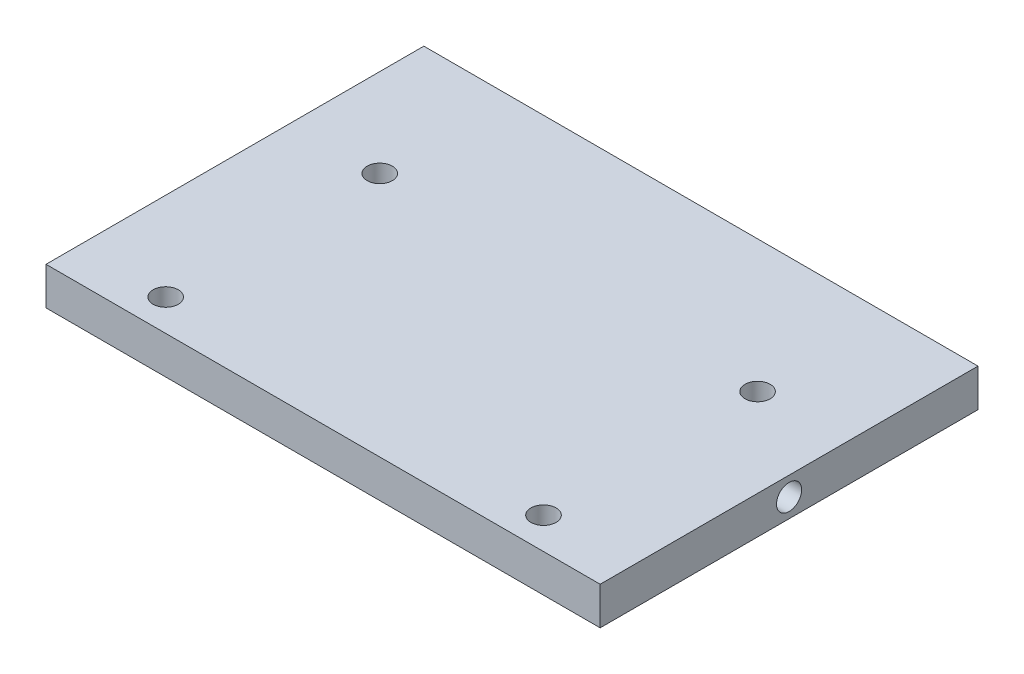
from build123d import *

# Parameters (mm, degrees)
SKETCH1_W           = 44
SKETCH1_H           = 30
BOSS_EXTRUDE1_DEPTH = 3
SKETCH2_R           = 1
CUT_EXTRUDE1_DEPTH  = 5
SKETCH3_R           = 1
CUT_EXTRUDE2_DEPTH  = 5


with BuildPart() as part:
    # Sketch1 → Boss-Extrude1 (new body)
    with BuildSketch(Plane(origin=(0, 0, 0), x_dir=(1, 0, 0), z_dir=(0, 1, 0))):
        Rectangle(SKETCH1_W, SKETCH1_H)
    extrude(amount=BOSS_EXTRUDE1_DEPTH)

    # Sketch2 → Cut-Extrude1 (cut)
    with BuildSketch(Plane.ZY.offset(22)):
        with Locations((0, 1.5)):
            Circle(SKETCH2_R)
    cut_extrude1 = extrude(amount=-CUT_EXTRUDE1_DEPTH, mode=Mode.SUBTRACT)

    # Mirror1: Cut-Extrude1 across plane
    add(cut_extrude1.mirror(Plane(origin=(0, 0, 0), x_dir=(0, 0, 1), z_dir=(1, 0, 0))), mode=Mode.SUBTRACT)

    # Sketch3 → Cut-Extrude2 (cut)
    with BuildSketch(Plane(origin=(0, 0, 0), x_dir=(-1, 0, 0), z_dir=(0, -1, 0))):
        with Locations(Location((15, 4.5, 0), (0, 0, 90))):
            Circle(SKETCH3_R)
        with Locations(Location((15, -12.5, 0), (0, 0, 90))):
            Circle(SKETCH3_R)
        with Locations(Location((-15, -12.5, 0), (0, 0, 90))):
            Circle(SKETCH3_R)
        with Locations(Location((-15, 4.5, 0), (0, 0, 90))):
            Circle(SKETCH3_R)
    extrude(amount=-CUT_EXTRUDE2_DEPTH, mode=Mode.SUBTRACT)


solid = part.part
